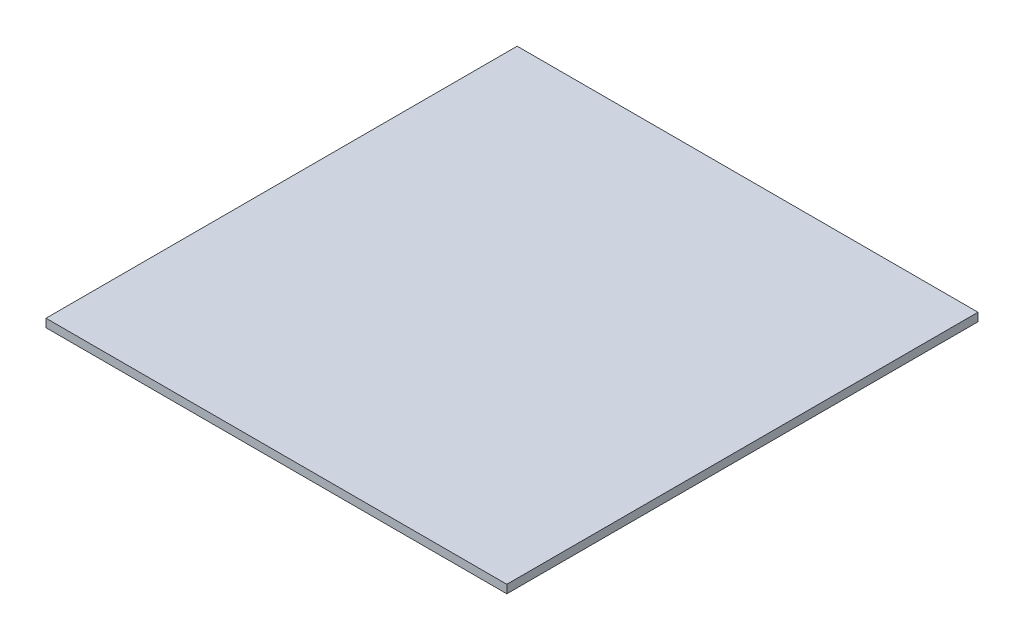
from build123d import *

# Parameters (mm, degrees)
SKETCH2_W           = 445
SKETCH2_H           = 455
BOSS_EXTRUDE1_DEPTH = 8


with BuildPart() as part:
    # Sketch2 → Boss-Extrude1 (new body)
    with BuildSketch(Plane(origin=(0, 0, 0), x_dir=(1, 0, 0), z_dir=(0, 1, 0))):
        with Locations((222.5, 227.5)):
            Rectangle(SKETCH2_W, SKETCH2_H)
    extrude(amount=BOSS_EXTRUDE1_DEPTH)


solid = part.part
